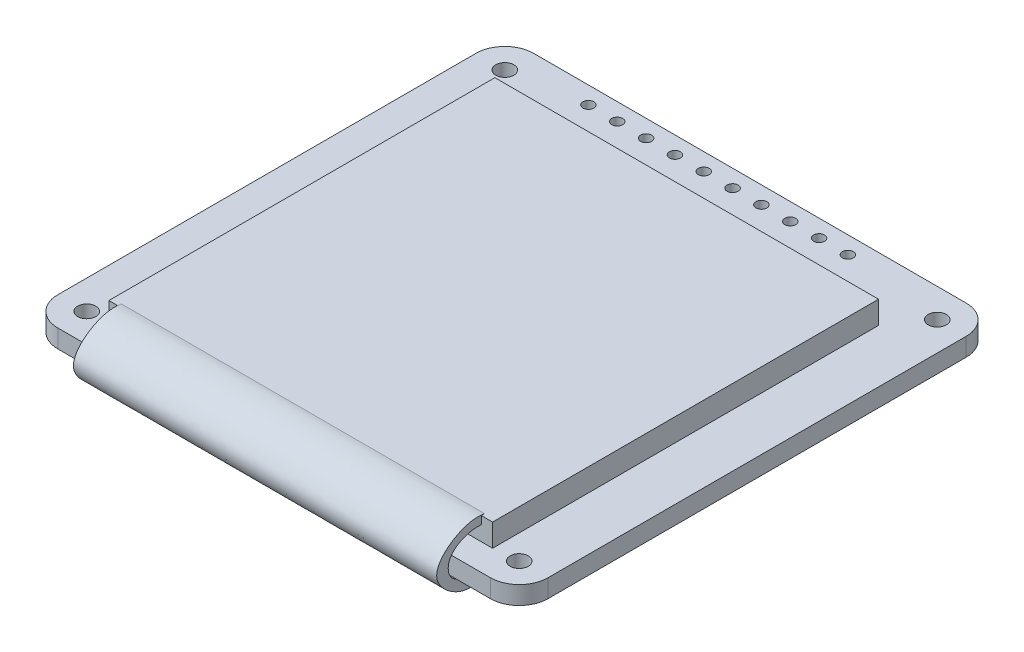
from build123d import *

# Parameters (mm, degrees)
SKETCH1_R           = 0.8
SKETCH1_R_2         = 0.4826
BOSS_EXTRUDE1_DEPTH = 1.6
SKETCH2_W           = 33.8
SKETCH2_H           = 34
BOSS_EXTRUDE2_DEPTH = 2
BOSS_EXTRUDE3_START = 5.5
BOSS_EXTRUDE3_DEPTH = 32


with BuildPart() as part:
    # Sketch1 → Boss-Extrude1 (new body)
    with BuildSketch(Plane(origin=(0, 0, 0), x_dir=(1, 0, 0), z_dir=(0, 1, 0))):
        with BuildLine():
            Line((40.64, 41.91), (2.54, 41.91))
            ThreePointArc((2.54, 41.91), (0.743948776, 41.166051224), (0, 39.37))
            Line((0, 39.37), (0, 2.54))
            ThreePointArc((0, 2.54), (0.743948776, 0.743948776), (2.54, 0))
            Line((2.54, 0), (40.64, 0))
            ThreePointArc((40.64, 0), (42.436051224, 0.743948776), (43.18, 2.54))
            Line((43.18, 2.54), (43.18, 39.37))
            ThreePointArc((43.18, 39.37), (42.436051224, 41.166051224), (40.64, 41.91))
        make_face()
        with Locations(Location((2.54, 39.37, 0), (0, 0, 270))):
            Circle(SKETCH1_R, mode=Mode.SUBTRACT)
        with Locations(Location((40.64, 39.37, 0), (0, 0, 270))):
            Circle(SKETCH1_R, mode=Mode.SUBTRACT)
        with Locations(Location((40.64, 2.54, 0), (0, 0, 270))):
            Circle(SKETCH1_R, mode=Mode.SUBTRACT)
        with Locations(Location((2.54, 2.54, 0), (0, 0, 270))):
            Circle(SKETCH1_R, mode=Mode.SUBTRACT)
        with Locations(Location((8.89, 40.386, 0), (0, 0, 270))):
            Circle(SKETCH1_R_2, mode=Mode.SUBTRACT)
        with Locations(Location((11.43, 40.386, 0), (0, 0, 270))):
            Circle(SKETCH1_R_2, mode=Mode.SUBTRACT)
        with Locations(Location((13.97, 40.386, 0), (0, 0, 270))):
            Circle(SKETCH1_R_2, mode=Mode.SUBTRACT)
        with Locations(Location((16.51, 40.386, 0), (0, 0, 270))):
            Circle(SKETCH1_R_2, mode=Mode.SUBTRACT)
        with Locations(Location((19.05, 40.386, 0), (0, 0, 270))):
            Circle(SKETCH1_R_2, mode=Mode.SUBTRACT)
        with Locations(Location((21.59, 40.386, 0), (0, 0, 270))):
            Circle(SKETCH1_R_2, mode=Mode.SUBTRACT)
        with Locations(Location((24.13, 40.386, 0), (0, 0, 270))):
            Circle(SKETCH1_R_2, mode=Mode.SUBTRACT)
        with Locations(Location((26.67, 40.386, 0), (0, 0, 270))):
            Circle(SKETCH1_R_2, mode=Mode.SUBTRACT)
        with Locations(Location((29.21, 40.386, 0), (0, 0, 270))):
            Circle(SKETCH1_R_2, mode=Mode.SUBTRACT)
        with Locations(Location((31.75, 40.386, 0), (0, 0, 270))):
            Circle(SKETCH1_R_2, mode=Mode.SUBTRACT)
    extrude(amount=BOSS_EXTRUDE1_DEPTH)

    # Sketch2 → Boss-Extrude2 (add)
    with BuildSketch(Plane(origin=(0, 1.6, 0), x_dir=(1, 0, 0), z_dir=(0, 1, 0))):
        with Locations((21.59, 19.343844511)):
            Rectangle(SKETCH2_W, SKETCH2_H)
    extrude(amount=BOSS_EXTRUDE2_DEPTH)

    # Sketch3 → Boss-Extrude3 (add)
    with BuildSketch(Plane(origin=(0, 0, 0), x_dir=(0, 0, -1), z_dir=(1, 0, 0)).offset(BOSS_EXTRUDE3_START)):
        with BuildLine():
            add(Edge.make_bspline(
                [(3.970164527, 3.105314779), (3.04053349, 3.600811343), (1.003377892, 4.056892842), (-2.896061137, 1.167055459), (0.099995748, -1.437870681), (2.983164085, -1.424066333), (8.281609372, -0.229546042), (5.182542742, 2.459112989), (3.970164527, 3.105314779)],
                knots=[0, 0, 0, 0, 0.142117757, 0.339134201, 0.495976707, 0.571841856, 0.814657142, 1, 1, 1, 1], degree=3))
        make_face()
        with BuildLine():
            add(Edge.make_bspline(
                [(4.08176927, 2.23180389), (3.305339462, 2.783945066), (1.536004114, 3.293046243), (-0.859930314, 1.862739832), (-0.461561334, 0.171086046), (1.128981968, -0.665819715), (3.168129753, -0.489558726), (4.994967134, 0.005583457), (5.157624087, 1.295448967), (4.40957126, 1.998694632), (4.08176927, 2.23180389)],
                knots=[0, 0, 0, 0, 0.200568943, 0.386570944, 0.476143886, 0.515165973, 0.747722274, 0.790644782, 0.915321516, 1, 1, 1, 1], degree=3))
        make_face(mode=Mode.SUBTRACT)
    extrude(amount=BOSS_EXTRUDE3_DEPTH)


solid = part.part
